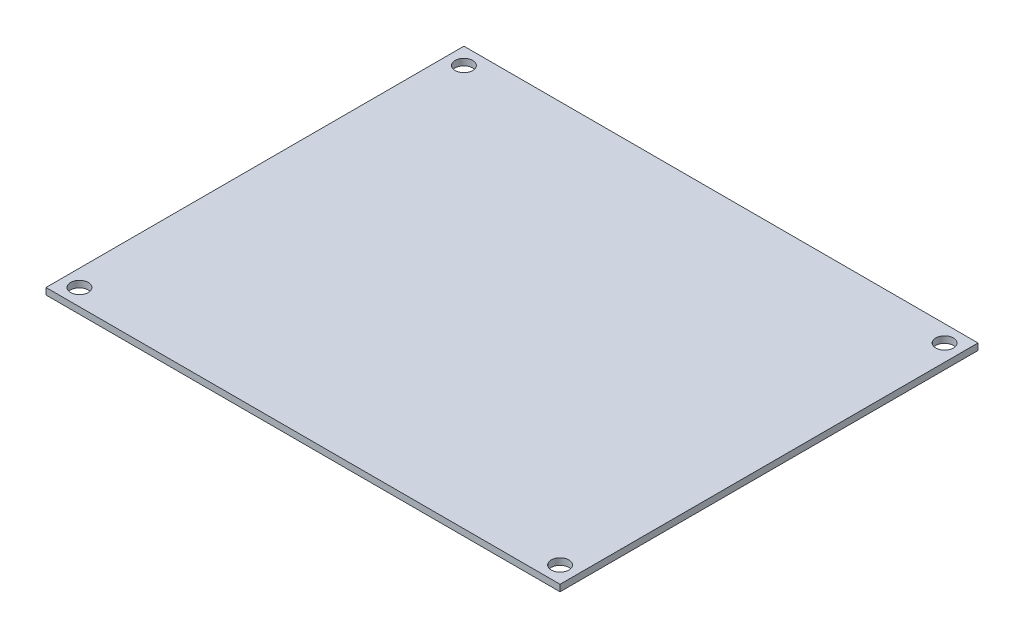
from build123d import *

# Parameters (mm, degrees)
SKETCH1_W           = 123
SKETCH1_H           = 100
SKETCH1_R           = 2.1
BOSS_EXTRUDE1_DEPTH = 1.57


with BuildPart() as part:
    # Sketch1 → Boss-Extrude1 (new body)
    with BuildSketch(Plane(origin=(0, 0, 0), x_dir=(1, 0, 0), z_dir=(0, 1, 0))):
        with Locations((61.5, 50)):
            Rectangle(SKETCH1_W, SKETCH1_H)
        with Locations(Location((4, 96, 0), (0, 0, 90))):
            Circle(SKETCH1_R, mode=Mode.SUBTRACT)
        with Locations(Location((119, 96, 0), (0, 0, 90))):
            Circle(SKETCH1_R, mode=Mode.SUBTRACT)
        with Locations(Location((119, 4, 0), (0, 0, 90))):
            Circle(SKETCH1_R, mode=Mode.SUBTRACT)
        with Locations(Location((4, 4, 0), (0, 0, 90))):
            Circle(SKETCH1_R, mode=Mode.SUBTRACT)
    extrude(amount=BOSS_EXTRUDE1_DEPTH)


solid = part.part
